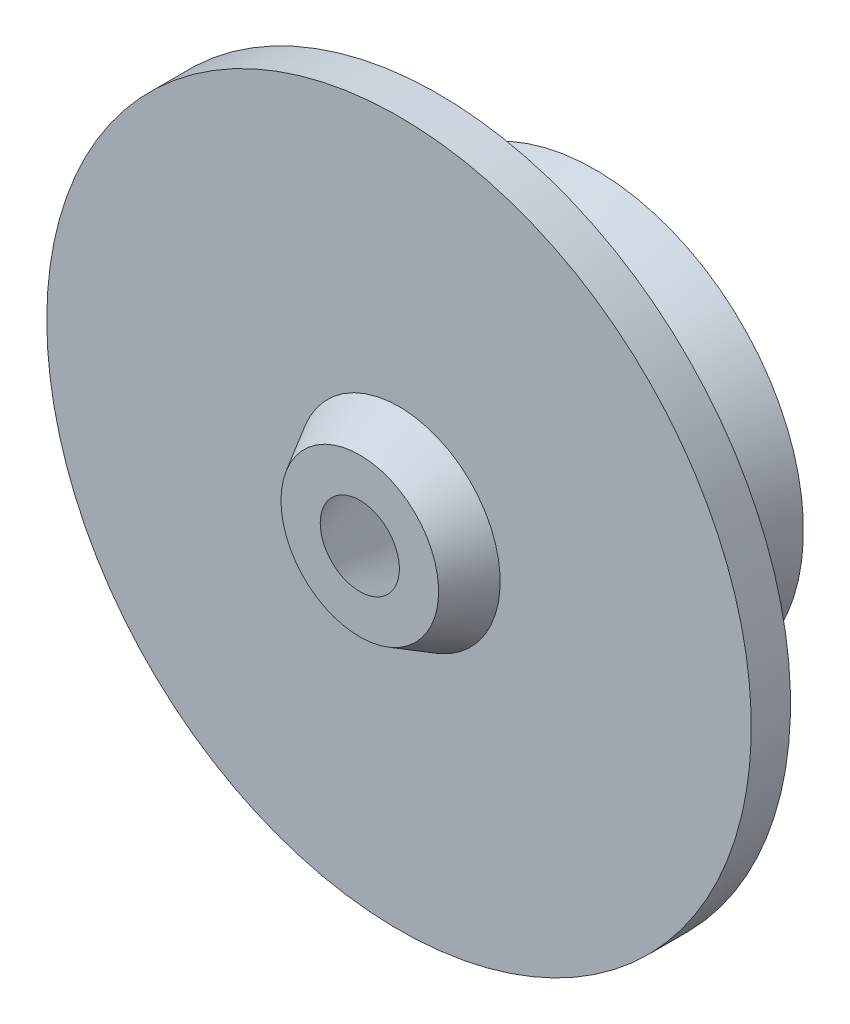
from build123d import *

# Parameters (mm, degrees)
FILLET1_R = 12.7


with BuildPart() as part:
    # Sketch1 → Revolve1 (revolve)
    with BuildSketch(Plane(origin=(0, 0, 0), x_dir=(1, 0, 0), z_dir=(0, 1, 0))):
        Polygon((-6.402170304, -5.603691702), (-24.16849208, 32.496308298), (-33.69349208, 32.496308298), (-21.849277563, 7.096308298), (-57.003438355, 7.096308298), (-57.003438355, 0.746308298), (-16.369673719, 0.746308298), (-12.752170304, -5.603691702), align=None)
    revolve(axis=Axis((0, 0, -42.597586509), (0, 0, 1)))

    # Fillet1
    fillet1_edges = [part.edges().sort_by_distance(p)[0] for p in [
        (21.849277563, 0, -7.096308298),
    ]]
    fillet(fillet1_edges, radius=FILLET1_R)


solid = part.part
